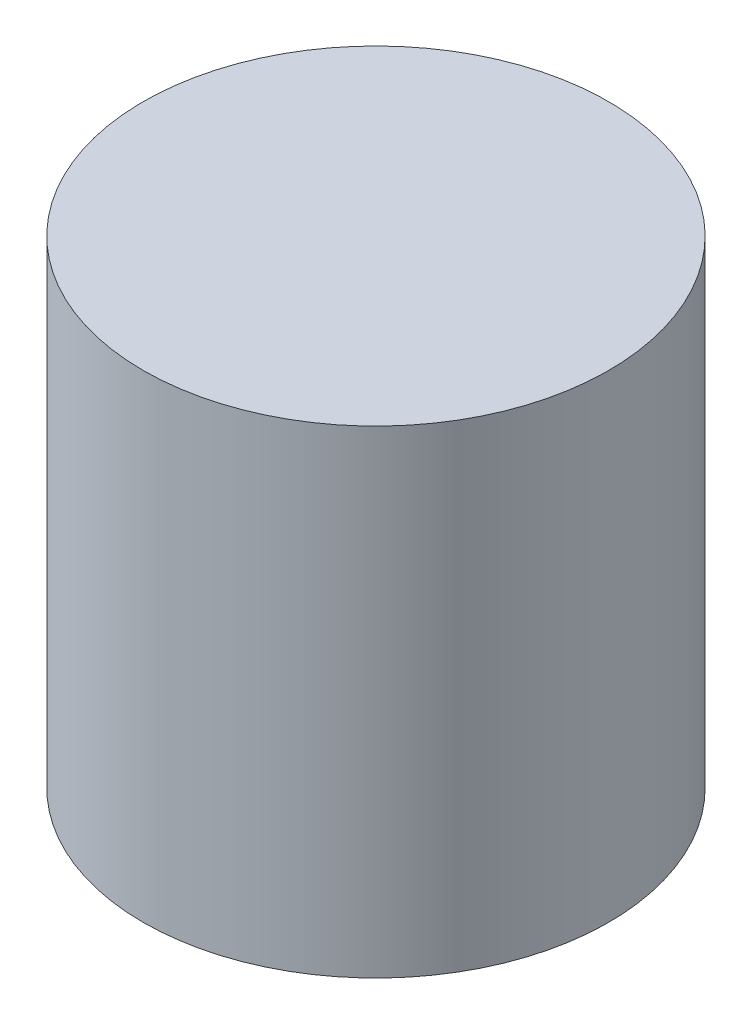
from build123d import *

# Parameters (mm, degrees)
SKETCH1_R           = 284.48
BOSS_EXTRUDE1_DEPTH = 584.2
SKETCH2_R           = 279.4
CUT_EXTRUDE1_DEPTH  = 558.8


with BuildPart() as part:
    # Sketch1 → Boss-Extrude1 (new body)
    with BuildSketch(Plane(origin=(0, 0, 0), x_dir=(1, 0, 0), z_dir=(0, 1, 0))):
        with Locations(Location((0, 0, 0), (0, 0, 270))):
            Circle(SKETCH1_R)
    extrude(amount=BOSS_EXTRUDE1_DEPTH)

    # Sketch2 → Cut-Extrude1 (cut)
    with BuildSketch(Plane(origin=(0, 0, 0), x_dir=(-1, 0, 0), z_dir=(0, -1, 0))):
        with Locations(Location((0, 0, 0), (0, 0, 90))):
            Circle(SKETCH2_R)
    extrude(amount=-CUT_EXTRUDE1_DEPTH, mode=Mode.SUBTRACT)


solid = part.part
